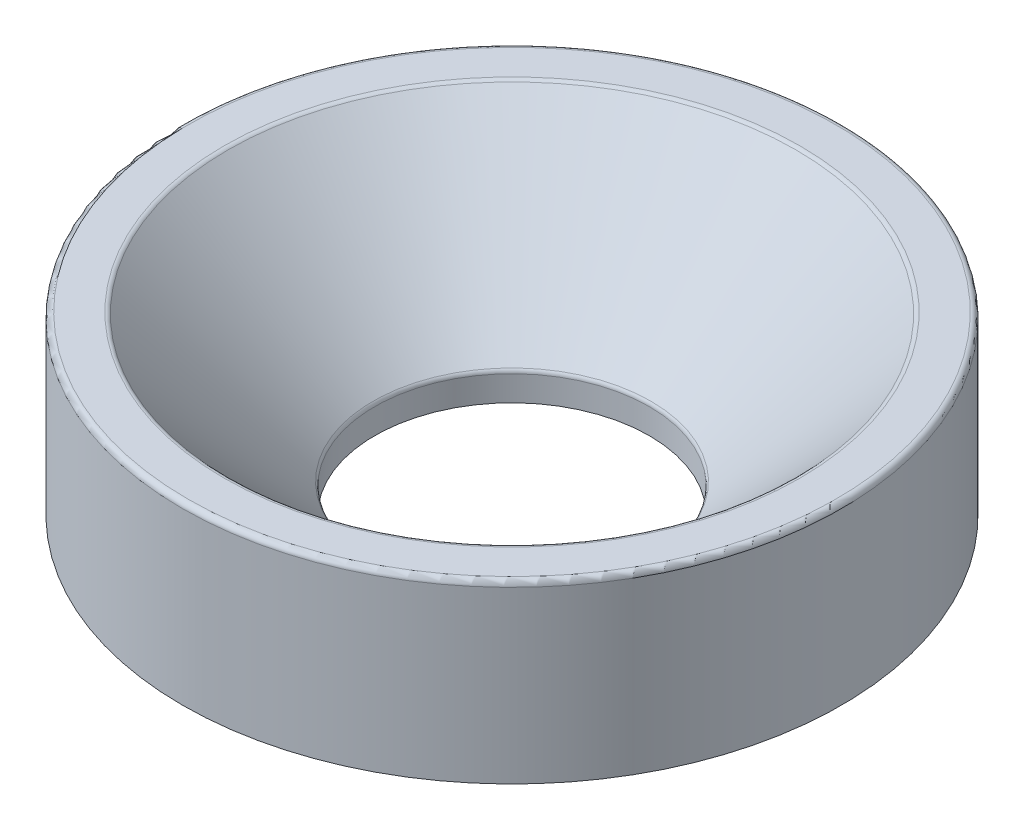
from build123d import *

# Parameters (mm, degrees)
SKETCH_1_R      = 6
SKETCH_1_R_2    = 2.5
EXTRUDE_1_DEPTH = 3.2
CHAMFER_1_SIZE  = 2.7
FILLET_1_R      = 0.1


with BuildPart() as part:
    # 草图1 → 凸台-拉伸1 (new body)
    with BuildSketch(Plane(origin=(0, 0, 0), x_dir=(1, 0, 0), z_dir=(0, 1, 0))):
        with Locations(Location((0, 0, 0), (0, 0, 270))):
            Circle(SKETCH_1_R)
        with Locations(Location((0, 0, 0), (0, 0, 270))):
            Circle(SKETCH_1_R_2, mode=Mode.SUBTRACT)
    extrude(amount=EXTRUDE_1_DEPTH)

    # 倒角1
    chamfer_1_edges = [part.edges().sort_by_distance(p)[0] for p in [
        (0, 3.2, -2.5),
    ]]
    chamfer(chamfer_1_edges, length=CHAMFER_1_SIZE)

    # 圆角1
    fillet_1_edges = [part.edges().sort_by_distance(p)[0] for p in [
        (0, 3.2, -5.2),
        (0, 3.2, -6),
        (0, 0.5, -2.5),
    ]]
    fillet(fillet_1_edges, radius=FILLET_1_R)


solid = part.part
